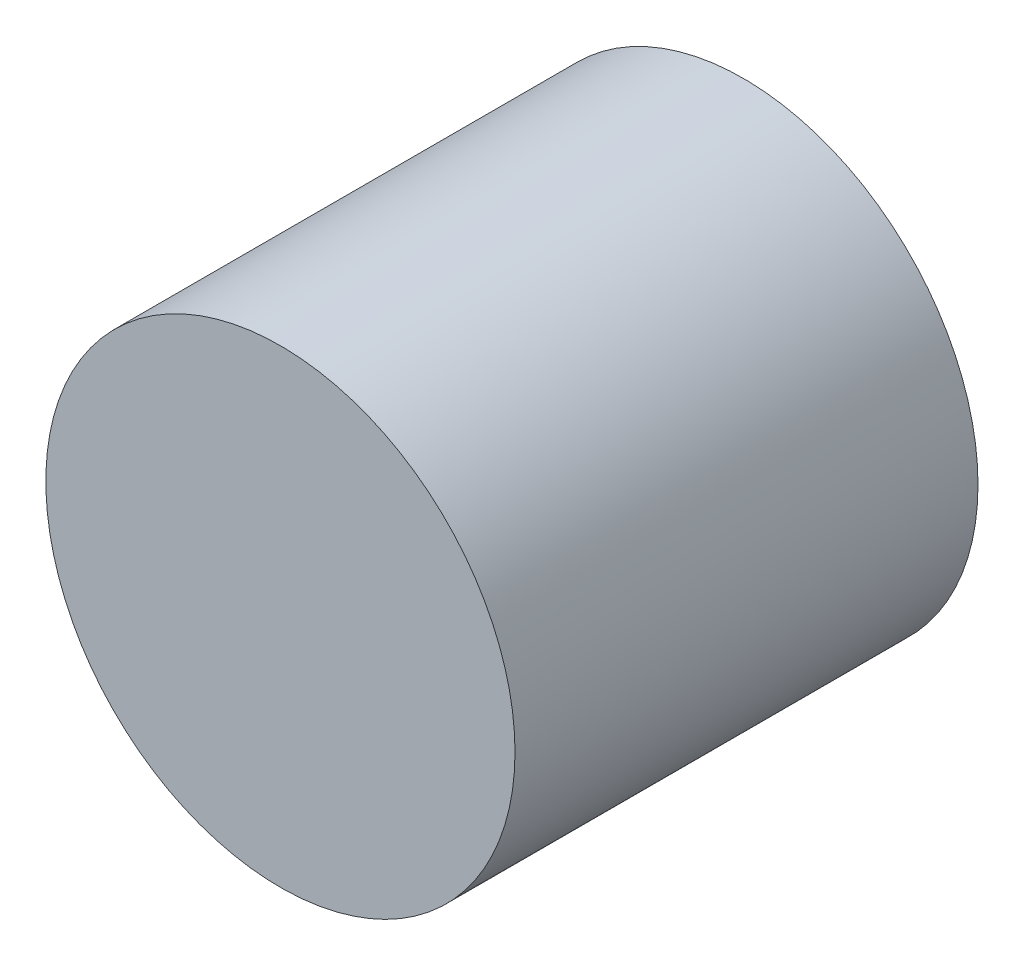
from build123d import *

# Parameters (mm, degrees)
SALIENTE_EXTRUIR1_DEPTH      = 21.604204
SALIENTE_EXTRUIR1_DEPTH_BACK = 8
CROQUIS1_R                   = 15


with BuildPart() as part:
    # Croquis1 → Saliente-Extruir1 (new, two sides: drawn at the far end of the back side and taken through both)
    with BuildSketch(Plane.XY.offset(-SALIENTE_EXTRUIR1_DEPTH_BACK)):
        with Locations((-4.976335362, -25.8)):
            Circle(CROQUIS1_R)
    extrude(amount=SALIENTE_EXTRUIR1_DEPTH + SALIENTE_EXTRUIR1_DEPTH_BACK)


solid = part.part
